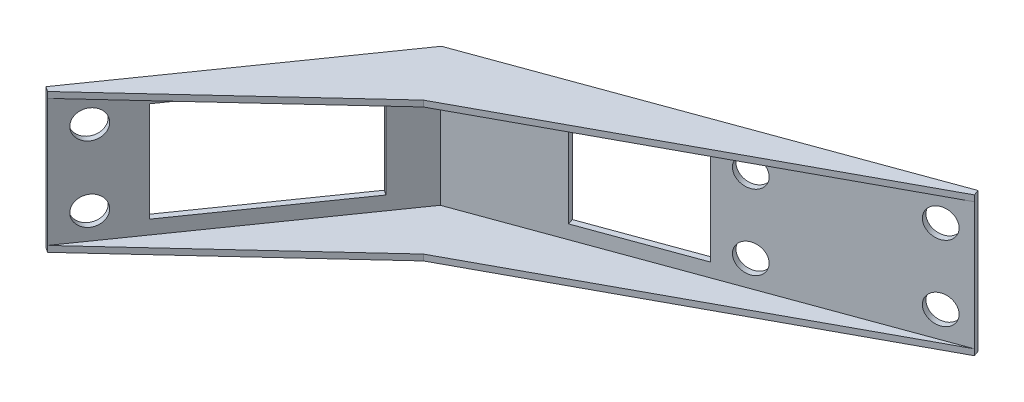
from build123d import *

# Parameters (mm, degrees)
BOSS_EXTRUDE1_DEPTH = 26.65
BOSS_EXTRUDE2_DEPTH = 1.25
BOSS_EXTRUDE3_DEPTH = 1.25
SKETCH4_R           = 3
CUT_EXTRUDE1_DEPTH  = 1.25
SKETCH5_R           = 3
CUT_EXTRUDE2_DEPTH  = 1.25
SKETCH6_W           = 35.469315919
SKETCH6_H           = 20.901561166
CUT_EXTRUDE3_DEPTH  = 1.25
CUT_EXTRUDE4_DEPTH  = 1.25
CUT_EXTRUDE5_DEPTH  = 41.25


with BuildPart() as part:
    # Sketch1 → Boss-Extrude1 (new body)
    with BuildSketch(Plane(origin=(0, 0, 0), x_dir=(1, 0, 0), z_dir=(0, 1, 0))):
        Polygon((65.740483752, 35.768961664), (-16.155551111, 5.899521732), (-49.97807415, -42.47004645), (-51.002473848, -41.753732791), (-16.954107408, 6.938813892), (65.312177163, 36.943292736), align=None)
    extrude(amount=BOSS_EXTRUDE1_DEPTH)

    # Sketch2 → Boss-Extrude2 (add)
    with BuildSketch(Plane(origin=(0, 26.65, 0), x_dir=(1, 0, 0), z_dir=(0, 1, 0))):
        Polygon((-51.002473848, -41.753732791), (-49.97807415, -42.47004645), (-7.877469848, -6.485888625), (65.740483752, 35.768961664), (65.312177163, 36.943292736), (-16.954107408, 6.938813892), align=None)
    extrude(amount=BOSS_EXTRUDE2_DEPTH)

    # Sketch3 → Boss-Extrude3 (add)
    with BuildSketch(Plane.XZ):
        Polygon((65.312177163, -36.943292736), (65.740483752, -35.768961664), (-7.877469848, 6.485888625), (-49.97807415, 42.47004645), (-51.002473848, 41.753732791), (-16.954107408, -6.938813892), align=None)
    extrude(amount=BOSS_EXTRUDE3_DEPTH)

    # Sketch4 → Cut-Extrude1 (cut)
    with BuildSketch(Plane(origin=(-4.224136578, 0, -11.581738298), x_dir=(-0.9394648571224508, 0, 0.34264527171973835), z_dir=(-0.34264527171973835, 0, -0.9394648571224508))):
        with Locations((-68.516939764, 21.15)):
            Circle(SKETCH4_R)
        with Locations((-37.516939764, 21.15)):
            Circle(SKETCH4_R)
        with Locations((-37.516939764, 5.5)):
            Circle(SKETCH4_R)
        with Locations((-68.516939764, 5.5)):
            Circle(SKETCH4_R)
    extrude(amount=-CUT_EXTRUDE1_DEPTH, mode=Mode.SUBTRACT)

    # Sketch5 → Cut-Extrude2 (cut)
    with BuildSketch(Plane(origin=(-14.645244024, 0, -10.240717915), x_dir=(-0.5730509275214783, 0, 0.819519758435862), z_dir=(-0.819519758435862, 0, -0.5730509275214783))):
        with Locations((57.095023955, 21.15)):
            Circle(SKETCH5_R)
        with Locations((57.095023955, 5.5)):
            Circle(SKETCH5_R)
    extrude(amount=-CUT_EXTRUDE2_DEPTH, mode=Mode.SUBTRACT)

    # Sketch6 → Cut-Extrude3 (cut)
    with BuildSketch(Plane(origin=(-14.645244024, 0, -10.240717915), x_dir=(-0.5730509275214783, 0, 0.819519758435862), z_dir=(-0.819519758435862, 0, -0.5730509275214783))):
        with Locations((30.344239524, 13.325)):
            Rectangle(SKETCH6_W, SKETCH6_H)
    extrude(amount=-CUT_EXTRUDE3_DEPTH, mode=Mode.SUBTRACT)

    # Sketch7 → Cut-Extrude4 (cut)
    with BuildSketch(Plane(origin=(-4.224136578, 0, -11.581738298), x_dir=(-0.9394648571224508, 0, 0.34264527171973835), z_dir=(-0.34264527171973835, 0, -0.9394648571224508))):
        Polygon((-13.799604913, 23.775780583), (-7.799604913, 23.775780583), (-7.799604913, 2.874219417), (-13.799604913, 2.874219417), (-30.928783923, 2.874219417), (-30.928783923, 23.775780583), align=None)
    extrude(amount=-CUT_EXTRUDE4_DEPTH, mode=Mode.SUBTRACT)

    # Sketch8 → Cut-Extrude5 (cut)
    with BuildSketch(Plane.XZ.offset(1.25)):
        Polygon((65.740483752, -35.768961664), (-9.082823105, 4.70312394), (-49.97807415, 42.47004645), (-7.877469848, 6.485888625), align=None)
    extrude(amount=-CUT_EXTRUDE5_DEPTH, mode=Mode.SUBTRACT)


solid = part.part
